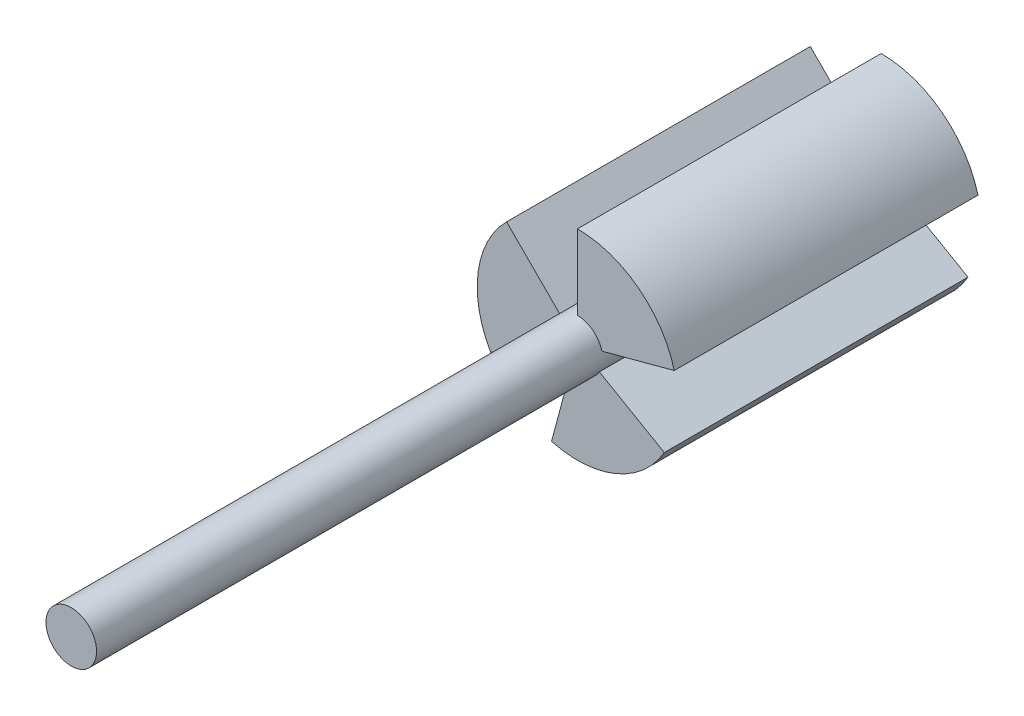
from build123d import *

# Parameters (mm, degrees)
SKETCH1_R           = 251.46
BOSS_EXTRUDE1_DEPTH = 762
CUT_EXTRUDE1_DEPTH  = 841.897296464
BOSS_EXTRUDE2_START = 1270
SKETCH3_R           = 63.5
BOSS_EXTRUDE2_DEPTH = 1270


with BuildPart() as part:
    # Sketch1 → Boss-Extrude1 (new body)
    with BuildSketch(Plane.XY):
        Circle(SKETCH1_R)
    extrude(amount=BOSS_EXTRUDE1_DEPTH)

    # Sketch2 → Cut-Extrude1 (cut, through all)
    with BuildSketch(Plane.XY.offset(762)):
        with BuildLine():
            Line((-44.901280605, 44.901280605), (-177.809071197, 177.809071197))
            ThreePointArc((-177.809071197, 177.809071197), (-96.229575903, 232.318747245), (0, 251.46))
            Line((0, 251.46), (0, 63.5))
            ThreePointArc((0, 63.5), (-24.300397955, 58.666350314), (-44.901280605, 44.901280605))
        make_face()
        with BuildLine():
            Line((61.336289969, 16.435009364), (242.891708279, 65.082637081))
            ThreePointArc((242.891708279, 65.082637081), (249.308724841, -32.822116296), (217.770748036, -125.73))
            Line((217.770748036, -125.73), (54.99261314, -31.75))
            ThreePointArc((54.99261314, -31.75), (62.956748697, -8.288413206), (61.336289969, 16.435009364))
        make_face()
        with BuildLine():
            Line((-16.435009364, -61.336289969), (-65.082637081, -242.891708279))
            ThreePointArc((-65.082637081, -242.891708279), (-153.079148939, -199.49663095), (-217.770748036, -125.73))
            Line((-217.770748036, -125.73), (-54.99261314, -31.75))
            ThreePointArc((-54.99261314, -31.75), (-38.656350742, -50.377937108), (-16.435009364, -61.336289969))
        make_face()
    extrude(amount=-CUT_EXTRUDE1_DEPTH, mode=Mode.SUBTRACT)

    # Sketch3 → Boss-Extrude2 (add)
    with BuildSketch(Plane.XY.offset(762).offset(BOSS_EXTRUDE2_START)):
        Circle(SKETCH3_R)
    extrude(amount=-BOSS_EXTRUDE2_DEPTH)


solid = part.part
